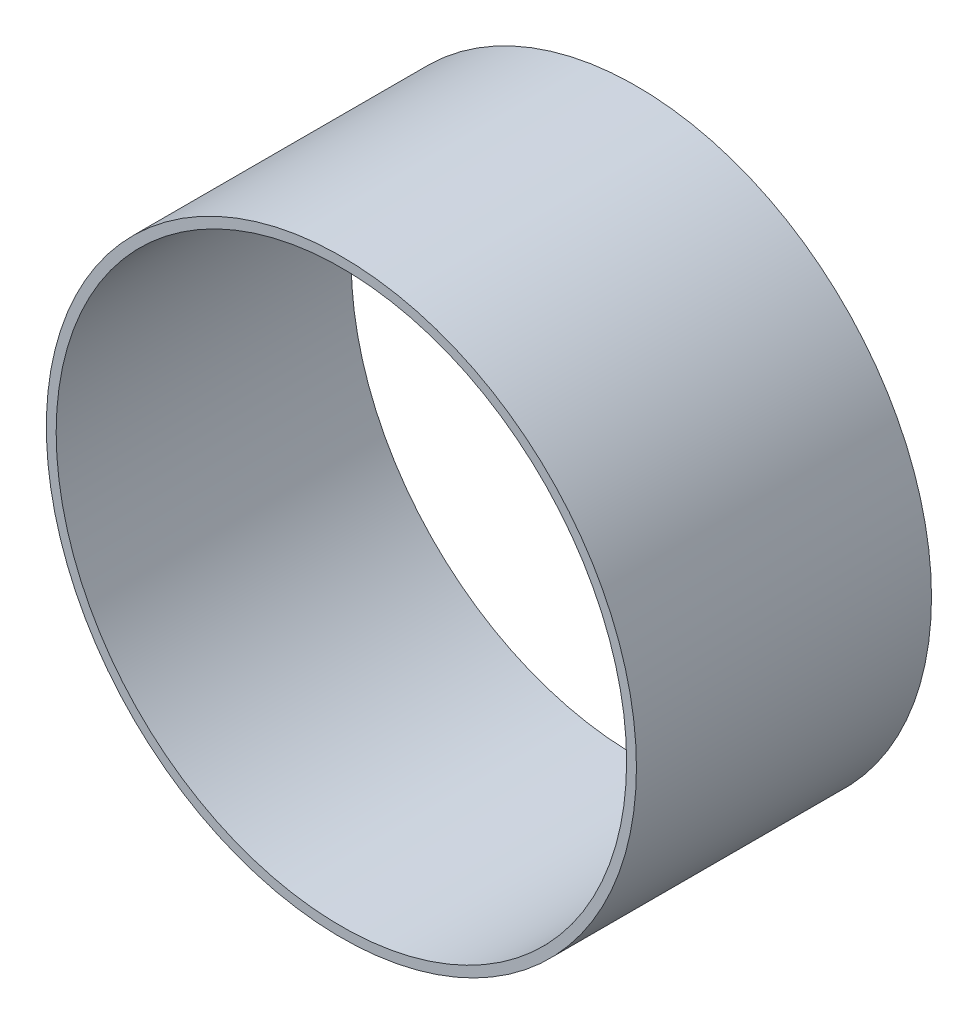
from build123d import *

# Parameters (mm, degrees)
SKETCH1_R           = 120
SKETCH1_R_2         = 116
BOSS_EXTRUDE1_DEPTH = 120


with BuildPart() as part:
    # Sketch1 → Boss-Extrude1 (new body)
    with BuildSketch(Plane.XY):
        Circle(SKETCH1_R)
        Circle(SKETCH1_R_2, mode=Mode.SUBTRACT)
    extrude(amount=BOSS_EXTRUDE1_DEPTH)


solid = part.part
